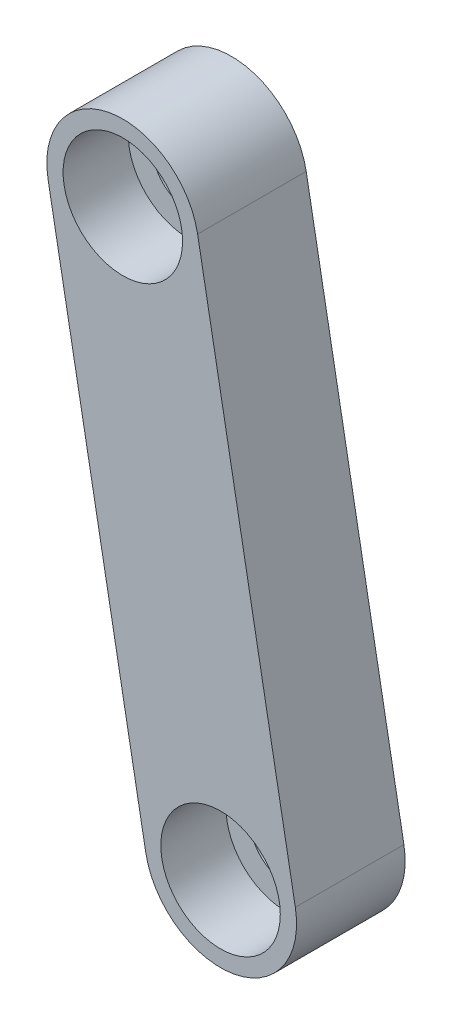
from build123d import *

# Parameters (mm, degrees)
SKETCH1_R           = 1.625
BOSS_EXTRUDE1_DEPTH = 5
SKETCH2_R           = 2.75
CUT_EXTRUDE1_DEPTH  = 3


with BuildPart() as part:
    # Sketch1 → Boss-Extrude1 (new body)
    with BuildSketch(Plane.XY):
        with BuildLine():
            Line((-14.551793335, 56.179232805), (-10.053522645, 31.587293274))
            ThreePointArc((-10.053522645, 31.587293274), (-5.980446308, 28.773953947), (-3.16710698, 32.847030284))
            Line((-3.16710698, 32.847030284), (-7.666056236, 57.438845684))
            ThreePointArc((-7.666056236, 57.438845684), (-11.738722536, 60.251860294), (-14.551793335, 56.179232805))
        make_face()
        with Locations((-6.609980089, 32.217131815)):
            Circle(SKETCH1_R, mode=Mode.SUBTRACT)
        with Locations((-11.108916097, 56.808991745)):
            Circle(SKETCH1_R, mode=Mode.SUBTRACT)
    extrude(amount=BOSS_EXTRUDE1_DEPTH)

    # Sketch2 → Cut-Extrude1 (cut)
    with BuildSketch(Plane.XY.offset(5)):
        with Locations((-11.108916097, 56.808991745)):
            Circle(SKETCH2_R)
        with Locations((-6.609980089, 32.217131815)):
            Circle(SKETCH2_R)
    extrude(amount=-CUT_EXTRUDE1_DEPTH, mode=Mode.SUBTRACT)


solid = part.part
